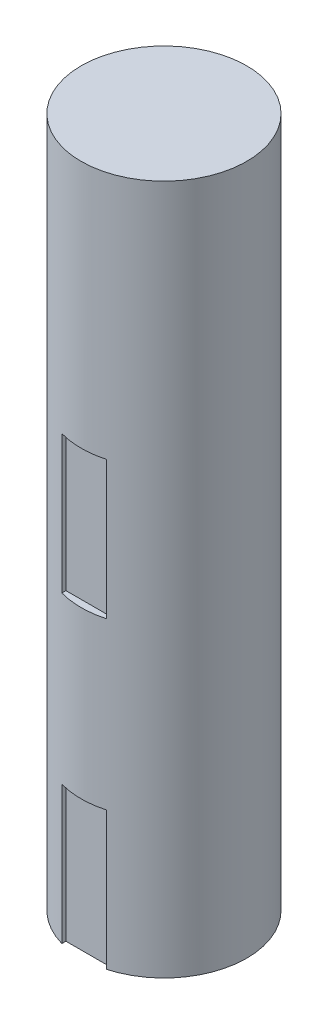
from build123d import *

# Parameters (mm, degrees)
SKETCH2_R           = 30
BOSS_EXTRUDE1_DEPTH = 125
CUT_EXTRUDE1_START  = -50
CUT_EXTRUDE1_DEPTH  = 50
CUT_EXTRUDE2_START  = -50
CUT_EXTRUDE2_DEPTH  = 50


with BuildPart() as part:
    # Sketch2 → Boss-Extrude1 (new, symmetric)
    with BuildSketch(Plane(origin=(0, 0, 0), x_dir=(1, 0, 0), z_dir=(0, 1, 0))):
        with Locations(Location((0, 0, 0), (0, 0, 270))):
            Circle(SKETCH2_R)
    extrude(amount=BOSS_EXTRUDE1_DEPTH, both=True)

    # Sketch3 → Cut-Extrude1 (cut)
    with BuildSketch(Plane.XZ.offset(125).offset(CUT_EXTRUDE1_START)):
        with BuildLine():
            ThreePointArc((-8.095335695, 28.887117197), (0, 30), (8.095335695, 28.887117197))
            Line((8.095335695, 28.887117197), (8.095335695, 34.42))
            Line((8.095335695, 34.42), (-8.095335695, 34.42))
            Line((-8.095335695, 34.42), (-8.095335695, 28.887117197))
        make_face()
        with BuildLine():
            Line((-8.095335695, 27.42), (8.095335695, 27.42))
            Line((8.095335695, 27.42), (8.095335695, 28.887117197))
            ThreePointArc((8.095335695, 28.887117197), (0, 30), (-8.095335695, 28.887117197))
            Line((-8.095335695, 28.887117197), (-8.095335695, 27.42))
        make_face()
    extrude(amount=CUT_EXTRUDE1_DEPTH, mode=Mode.SUBTRACT)

    # Sketch4 → Cut-Extrude2 (cut)
    with BuildSketch(Plane(origin=(0, -15, 0), x_dir=(-1, 0, 0), z_dir=(0, -1, 0)).offset(CUT_EXTRUDE2_START)):
        with BuildLine():
            Line((8.095335695, -28.887117197), (8.095335695, -27.42))
            Line((8.095335695, -27.42), (-8.095335695, -27.42))
            Line((-8.095335695, -27.42), (-8.095335695, -28.887117197))
            ThreePointArc((-8.095335695, -28.887117197), (0, -30), (8.095335695, -28.887117197))
        make_face()
    extrude(amount=CUT_EXTRUDE2_DEPTH, mode=Mode.SUBTRACT)


solid = part.part
